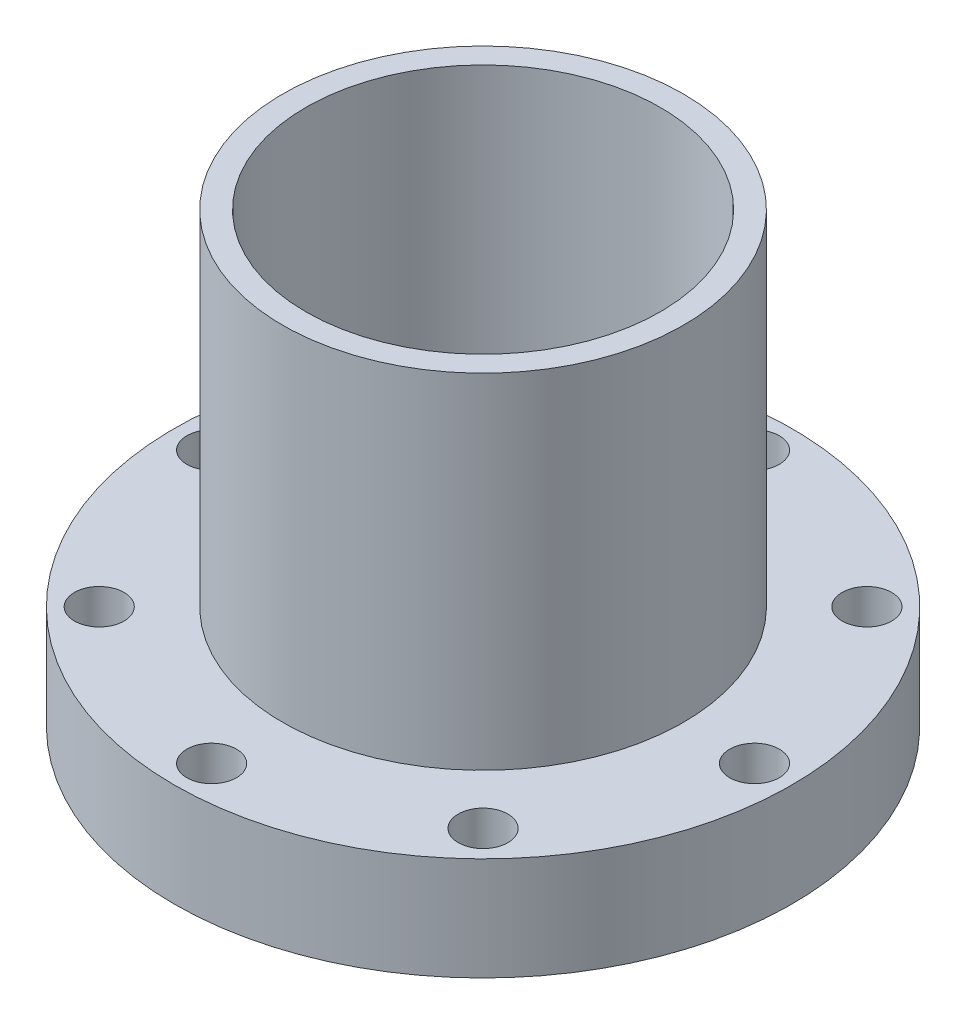
from build123d import *

# Parameters (mm, degrees)
SKETCH1_R               = 34.036
EXTRUDE1_DEPTH          = 58.42
SKETCH2_R               = 52.451
EXTRUDE2_DEPTH          = 17.526
CUT_EXTRUDE1_DEPTH      = 95.419866564
CUT_EXTRUDE1_DEPTH_BACK = 95.419866564
SKETCH3_R               = 30.099
SKETCH4_R               = 4.2164
CUT_EXTRUDE2_DEPTH      = 17.526
CIRPATTERN1_COUNT       = 8
CIRPATTERN3_COUNT       = 8


with BuildPart() as part:
    # Sketch1 → Extrude1 (new body)
    with BuildSketch(Plane(origin=(0, 0, 0), x_dir=(1, 0, 0), z_dir=(0, 1, 0))):
        Circle(SKETCH1_R)
    extrude(amount=EXTRUDE1_DEPTH)

    # Sketch2 → Extrude2 (add)
    with BuildSketch(Plane(origin=(0, 0, 0), x_dir=(1, 0, 0), z_dir=(0, 1, 0))):
        Circle(SKETCH2_R)
    extrude(amount=-EXTRUDE2_DEPTH)

    # Sketch3 → Cut-Extrude1 (cut, two sides: drawn at the far end of the back side and taken through both)
    with BuildSketch(Plane(origin=(0, 0, 0), x_dir=(1, 0, 0), z_dir=(0, 1, 0)).offset(-CUT_EXTRUDE1_DEPTH_BACK)):
        Circle(SKETCH3_R)
    extrude(amount=CUT_EXTRUDE1_DEPTH + CUT_EXTRUDE1_DEPTH_BACK, mode=Mode.SUBTRACT)

    # Sketch4 → Cut-Extrude2 (cut)
    with BuildSketch(Plane(origin=(0, 0, 0), x_dir=(1, 0, 0), z_dir=(0, 1, 0))):
        with Locations((0, 46.101)):
            Circle(SKETCH4_R)
    cut_extrude2 = extrude(amount=-CUT_EXTRUDE2_DEPTH, mode=Mode.SUBTRACT)

    # CirPattern1: Cut-Extrude2 ×8 about axis
    cirpattern1_axis = Axis((0, 58.676993495, 0), (0, -1, 0))
    for i in range(1, CIRPATTERN1_COUNT):
        add(cut_extrude2.rotate(cirpattern1_axis, i * 360 / CIRPATTERN1_COUNT), mode=Mode.SUBTRACT)

    # Sketch10 → 1/4-20 Tapped Hole2 (revolve, cut)
    with BuildSketch(Plane(origin=(13.365218875, -17.526, 32.266492673), x_dir=(0, 0, -1), z_dir=(1, 0, 0))):
        Polygon((0, 0), (0, 15.503816902), (2.5527, 13.97), (2.5527, 0), align=None)
    f_1_4_20_tapped_hole2 = revolve(axis=Axis((13.365218875, -23.876, 32.266492673), (0, 1, 0)), mode=Mode.SUBTRACT)

    # CirPattern3: 1/4-20 Tapped Hole2 ×8 about axis
    cirpattern3_axis = Axis((0, 58.676993495, 0), (0, -1, 0))
    for i in range(1, CIRPATTERN3_COUNT):
        add(f_1_4_20_tapped_hole2.rotate(cirpattern3_axis, i * 360 / CIRPATTERN3_COUNT), mode=Mode.SUBTRACT)


solid = part.part
